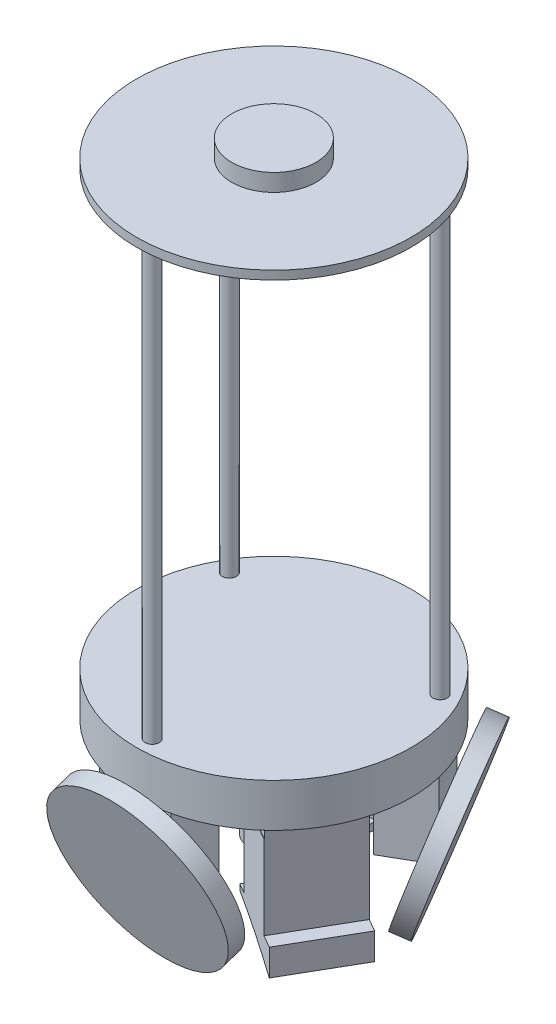
from build123d import *

# Parameters (mm, degrees)
SKETCH_2_R               = 31.689767185
EXTRUDE_1_DEPTH          = 10
SKETCH_3_W               = 11.398540158
SKETCH_3_H               = 11.018588819
EXTRUDE_2_DEPTH          = 20
CUT_EXTRUDE_1_DEPTH      = 20
SKETCH_6_R               = 20
EXTRUDE_3_DEPTH          = 4
PATTERN_CIRCULAR_2_COUNT = 3
EXTRUDE_4_DEPTH          = 4
EXTRUDE_5_DEPTH          = 17.8
PATTERN_CIRCULAR_3_COUNT = 3
SKETCH_9_R               = 5.625050713
EXTRUDE_6_DEPTH          = 19
SKETCH_10_R              = 1.630795406
EXTRUDE_7_DEPTH          = 100
PATTERN_CIRCULAR_4_COUNT = 3
SKETCH_11_R              = 31.689767185
EXTRUDE_8_DEPTH          = 2
SKETCH_12_R              = 9.724605512
EXTRUDE_9_DEPTH          = 4


with BuildPart() as part:
    # 草图2 → 凸台-拉伸1 (new body)
    with BuildSketch(Plane(origin=(0, 0, 0), x_dir=(1, 0, 0), z_dir=(0, 1, 0))):
        with Locations(Location((0, 0, 0), (0, 0, 270))):
            Circle(SKETCH_2_R)
    extrude(amount=EXTRUDE_1_DEPTH)

    # 草图3 → 凸台-拉伸2 (add)
    with BuildSketch(Plane.XZ):
        with Locations((0, 23.889440414)):
            Rectangle(SKETCH_3_W, SKETCH_3_H)
    extrude_2 = extrude(amount=EXTRUDE_2_DEPTH)

    # 草图4 → 切除-拉伸1 (cut)
    with BuildSketch(Plane(origin=(5.699270079, 0, 0), x_dir=(0, 0, -1), z_dir=(1, 0, 0))):
        Polygon((-29.398734823, -10), (-26.056890095, -20), (-29.398734823, -20), align=None)
    cut_extrude_1 = extrude(amount=-CUT_EXTRUDE_1_DEPTH, mode=Mode.SUBTRACT)

    # 草图6 → 凸台-拉伸3 (add)
    with BuildSketch(Plane(origin=(0, -9.842221306, 29.451462012), x_dir=(1, 0, 0), z_dir=(0, -0.316954203171244, 0.9484408432222232))):
        with Locations(Location((0, -5.578767415, 0), (0, 0, 270))):
            Circle(SKETCH_6_R)
    extrude_3 = extrude(amount=EXTRUDE_3_DEPTH)

    # 阵列(圆周)2: 凸台-拉伸2, 切除-拉伸1, 凸台-拉伸3 ×3 about axis
    pattern_circular_2_axis = Axis((0, 0, 0), (0, 1, 0))
    add([extrude_2.rotate(pattern_circular_2_axis, i * 360 / PATTERN_CIRCULAR_2_COUNT) for i in range(1, PATTERN_CIRCULAR_2_COUNT)])
    add([cut_extrude_1.rotate(pattern_circular_2_axis, i * 360 / PATTERN_CIRCULAR_2_COUNT) for i in range(1, PATTERN_CIRCULAR_2_COUNT)], mode=Mode.SUBTRACT)
    add([extrude_3.rotate(pattern_circular_2_axis, i * 360 / PATTERN_CIRCULAR_2_COUNT) for i in range(1, PATTERN_CIRCULAR_2_COUNT)])

    # 草图7 → 凸台-拉伸4 (add)
    with BuildSketch(Plane.XZ):
        with BuildLine():
            Line((-4.433868769, 7.679685983), (0, 10.23958131))
            Line((0, 10.23958131), (-19.030711532, 21.226967736))
            Line((-19.030711532, 21.226967736), (-27.898449071, 5.86759577))
            Line((-27.898449071, 5.86759577), (-8.867737539, -5.119790655))
            Line((-8.867737539, -5.119790655), (-8.867737539, 0))
            ThreePointArc((-8.867737539, 0), (-7.679685983, 4.433868769), (-4.433868769, 7.679685983))
        make_face()
        with BuildLine():
            ThreePointArc((4.433868769, 7.679685983), (7.679685983, 4.433868769), (8.867737539, 0))
            Line((8.867737539, 0), (8.867737539, -5.119790655))
            Line((8.867737539, -5.119790655), (27.898449071, 5.86759577))
            Line((27.898449071, 5.86759577), (19.030711532, 21.226967736))
            Line((19.030711532, 21.226967736), (0, 10.23958131))
            Line((0, 10.23958131), (4.433868769, 7.679685983))
        make_face()
        with BuildLine():
            Line((8.867737539, -27.094563507), (8.867737539, -5.119790655))
            Line((8.867737539, -5.119790655), (4.433868769, -7.679685983))
            ThreePointArc((4.433868769, -7.679685983), (0, -8.867737539), (-4.433868769, -7.679685983))
            Line((-4.433868769, -7.679685983), (-8.867737539, -5.119790655))
            Line((-8.867737539, -5.119790655), (-8.867737539, -27.094563507))
            Line((-8.867737539, -27.094563507), (8.867737539, -27.094563507))
        make_face()
        with BuildLine():
            ThreePointArc((4.433868769, -7.679685983), (7.679685983, -4.433868769), (8.867737539, 0))
            ThreePointArc((8.867737539, 0), (7.679685983, 4.433868769), (4.433868769, 7.679685983))
            ThreePointArc((4.433868769, 7.679685983), (0, 8.867737539), (-4.433868769, 7.679685983))
            ThreePointArc((-4.433868769, 7.679685983), (-7.679685983, 4.433868769), (-8.867737539, 0))
            ThreePointArc((-8.867737539, 0), (-7.679685983, -4.433868769), (-4.433868769, -7.679685983))
            ThreePointArc((-4.433868769, -7.679685983), (0, -8.867737539), (4.433868769, -7.679685983))
        make_face()
        with BuildLine():
            Line((8.867737539, -5.119790655), (8.867737539, 0))
            ThreePointArc((8.867737539, 0), (7.679685983, -4.433868769), (4.433868769, -7.679685983))
            Line((4.433868769, -7.679685983), (8.867737539, -5.119790655))
        make_face()
        with BuildLine():
            Line((-8.867737539, -5.119790655), (-4.433868769, -7.679685983))
            ThreePointArc((-4.433868769, -7.679685983), (-7.679685983, -4.433868769), (-8.867737539, 0))
            Line((-8.867737539, 0), (-8.867737539, -5.119790655))
        make_face()
        with BuildLine():
            ThreePointArc((-4.433868769, 7.679685983), (0, 8.867737539), (4.433868769, 7.679685983))
            Line((4.433868769, 7.679685983), (0, 10.23958131))
            Line((0, 10.23958131), (-4.433868769, 7.679685983))
        make_face()
    extrude(amount=EXTRUDE_4_DEPTH)

    # 草图8 → 凸台-拉伸5 (add)
    with BuildSketch(Plane(origin=(4.433868769, 0, -7.679685983), x_dir=(-0.8660254037844431, 0, -0.499999999999992), z_dir=(0.49999999999999206, 0, -0.8660254037844433))):
        with BuildLine():
            Line((-30.427113752, -29.482756554), (-30.427113752, -23.325905307))
            Line((-30.427113752, -23.325905307), (-27.094563507, -23.325905307))
            Line((-27.094563507, -23.325905307), (-27.094563507, -4))
            Line((-27.094563507, -4), (-14.617014317, -4))
            Line((-14.617014317, -4), (-14.617014317, -23.325905307))
            Line((-14.617014317, -23.325905307), (-11.847477178, -23.325905307))
            Line((-11.847477178, -23.325905307), (-11.847477178, -24.665032542))
            ThreePointArc((-11.847477178, -24.665032542), (-21.274112807, -26.546256084), (-30.427113752, -29.482756554))
        make_face()
    extrude_5 = extrude(amount=-EXTRUDE_5_DEPTH)

    # 阵列(圆周)3: 凸台-拉伸5 ×3 about axis
    pattern_circular_3_axis = Axis((0, 0, 0), (0, 1, 0))
    for i in range(1, PATTERN_CIRCULAR_3_COUNT):
        add(extrude_5.rotate(pattern_circular_3_axis, i * 360 / PATTERN_CIRCULAR_3_COUNT))

    # 草图9 → 凸台-拉伸6 (add)
    with BuildSketch(Plane.XZ.offset(4)):
        with Locations(Location((0, 0, 0), (0, 0, 270))):
            Circle(SKETCH_9_R)
    extrude(amount=EXTRUDE_6_DEPTH)

    # 草图10 → 凸台-拉伸7 (add)
    with BuildSketch(Plane(origin=(0, 10, 0), x_dir=(1, 0, 0), z_dir=(0, 1, 0))):
        with Locations(Location((0, -28.081418828, 0), (0, 0, 270))):
            Circle(SKETCH_10_R)
    extrude_7 = extrude(amount=EXTRUDE_7_DEPTH)

    # 阵列(圆周)4: 凸台-拉伸7 ×3 about axis
    pattern_circular_4_axis = Axis((0, 0, 0), (0, 1, 0))
    for i in range(1, PATTERN_CIRCULAR_4_COUNT):
        add(extrude_7.rotate(pattern_circular_4_axis, i * 360 / PATTERN_CIRCULAR_4_COUNT))

    # 草图11 → 凸台-拉伸8 (add)
    with BuildSketch(Plane(origin=(0, 110, 0), x_dir=(1, 0, 0), z_dir=(0, 1, 0))):
        with Locations(Location((0, 0, 0), (0, 0, 270))):
            Circle(SKETCH_11_R)
    extrude(amount=EXTRUDE_8_DEPTH)

    # 草图12 → 凸台-拉伸9 (add)
    with BuildSketch(Plane(origin=(0, 112, 0), x_dir=(1, 0, 0), z_dir=(0, 1, 0))):
        with Locations(Location((0, 0, 0), (0, 0, 270))):
            Circle(SKETCH_12_R)
    extrude(amount=EXTRUDE_9_DEPTH)


solid = part.part
